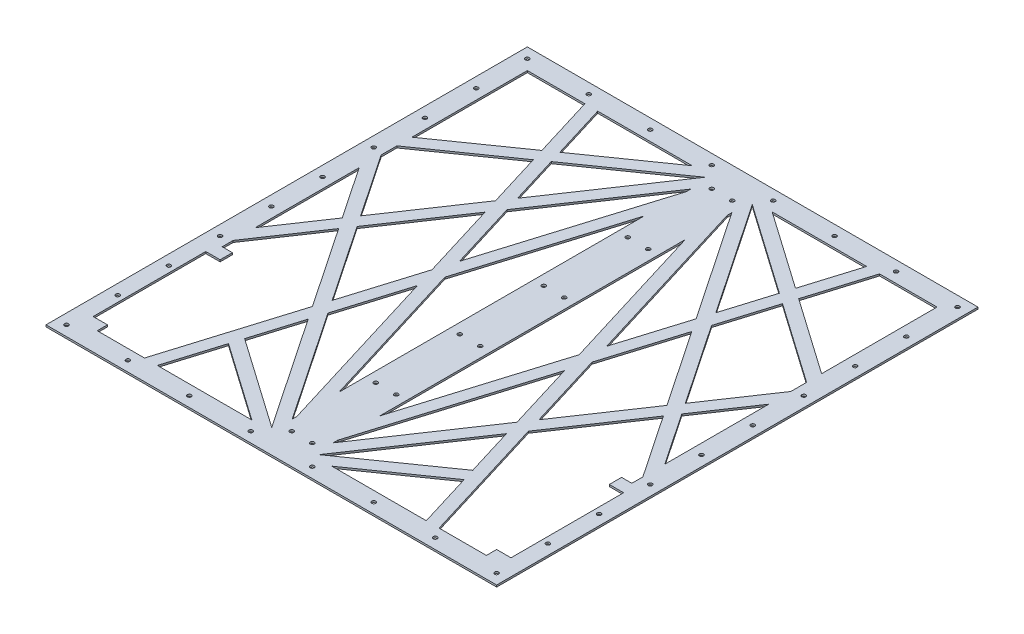
from build123d import *

# Parameters (mm, degrees)
SKETCH1_W                 = 558.8
SKETCH1_H                 = 596.9
BOSS_EXTRUDE1_DEPTH       = 2.286
CUT_EXTRUDE1_DEPTH        = 818.650460647
CUT_EXTRUDE2_REACH        = 819.65
SKETCH8_R                 = 2.4638
CUT_EXTRUDE3_DEPTH        = 818.650460647
LPATTERN1_COUNT           = 8
LPATTERN1_PITCH           = 76.2
LPATTERN2_COUNT           = 2
LPATTERN2_PITCH           = 571.5
LPATTERN2_COPY_1_SKETCH_R = 2.4638
LPATTERN2_COPY_1_DEPTH    = 818.650460647
LPATTERN2_COPY_2_SKETCH_R = 2.4638
LPATTERN2_COPY_2_DEPTH    = 818.650460647
LPATTERN2_COPY_3_SKETCH_R = 2.4638
LPATTERN2_COPY_3_DEPTH    = 818.650460647
LPATTERN2_COPY_4_SKETCH_R = 2.4638
LPATTERN2_COPY_4_DEPTH    = 818.650460647
LPATTERN2_COPY_5_SKETCH_R = 2.4638
LPATTERN2_COPY_5_DEPTH    = 818.650460647
LPATTERN2_COPY_6_SKETCH_R = 2.4638
LPATTERN2_COPY_6_DEPTH    = 818.650460647
LPATTERN2_COPY_7_SKETCH_R = 2.4638
LPATTERN2_COPY_7_DEPTH    = 818.650460647
LPATTERN3_COUNT           = 9
LPATTERN3_PITCH           = 63.5
LPATTERN4_COPY_1_SKETCH_R = 2.4638
LPATTERN4_COPY_1_DEPTH    = 818.650460647
LPATTERN4_COPY_2_SKETCH_R = 2.4638
LPATTERN4_COPY_2_DEPTH    = 818.650460647
LPATTERN4_COPY_3_SKETCH_R = 2.4638
LPATTERN4_COPY_3_DEPTH    = 818.650460647
LPATTERN4_COPY_4_SKETCH_R = 2.4638
LPATTERN4_COPY_4_DEPTH    = 818.650460647
LPATTERN4_COPY_5_SKETCH_R = 2.4638
LPATTERN4_COPY_5_DEPTH    = 818.650460647
LPATTERN4_COPY_6_SKETCH_R = 2.4638
LPATTERN4_COPY_6_DEPTH    = 818.650460647
LPATTERN4_COPY_7_SKETCH_R = 2.4638
LPATTERN4_COPY_7_DEPTH    = 818.650460647
LPATTERN4_COPY_8_SKETCH_R = 2.4638
LPATTERN4_COPY_8_DEPTH    = 818.650460647
LPATTERN4_COPY_9_SKETCH_R = 2.4638
LPATTERN4_COPY_9_DEPTH    = 818.650460647
SKETCH9_R                 = 2.4638
CUT_EXTRUDE4_DEPTH        = 818.650460647
LPATTERN5_COUNT           = 6
LPATTERN5_PITCH           = 104.14
CUT_EXTRUDE5_REACH        = 819.65


with BuildPart() as part:
    # Sketch1 → Boss-Extrude1 (new body)
    with BuildSketch(Plane(origin=(0, 0, 0), x_dir=(1, 0, 0), z_dir=(0, 1, 0))):
        with Locations((279.4, 298.45)):
            Rectangle(SKETCH1_W, SKETCH1_H)
    extrude(amount=BOSS_EXTRUDE1_DEPTH)

    # Sketch2 → Cut-Extrude1 (cut, through all)
    with BuildSketch(Plane(origin=(0, 2.286, 0), x_dir=(1, 0, 0), z_dir=(0, 1, 0))):
        Polygon((538.48, 38.1), (520.7, 38.1), (495.3, 76.2), (495.3, 139.7), (520.7, 177.8), (538.48, 177.8), align=None)
    cut_extrude1 = extrude(amount=-CUT_EXTRUDE1_DEPTH, mode=Mode.SUBTRACT)

    # Sketch5 → Cut-Extrude2 (cut, up to next)
    with BuildSketch(Plane(origin=(0, 2.286, 0), x_dir=(1, 0, 0), z_dir=(0, 1, 0)), mode=Mode.PRIVATE) as cut_extrude2_sk1:
        Polygon((510.850466187, 25.4), (480.06, 71.585699281), (480.06, 131.201342251), (438.618191365, 102.183475447), (462.093255638, 25.4), align=None)
    cut_extrude2_tool1 = extrude(cut_extrude2_sk1.sketch, amount=-CUT_EXTRUDE2_REACH, mode=Mode.PRIVATE) & part.part
    # Sketch5 → Cut-Extrude2 (cut, up to next)
    with BuildSketch(Plane(origin=(0, 2.286, 0), x_dir=(1, 0, 0), z_dir=(0, 1, 0)), mode=Mode.PRIVATE) as cut_extrude2_sk2:
        Polygon((328.960023954, 25.4), (446.156913269, 25.4), (425.491866124, 92.992323565), align=None)
    cut_extrude2_tool2 = extrude(cut_extrude2_sk2.sketch, amount=-CUT_EXTRUDE2_REACH, mode=Mode.PRIVATE) & part.part
    # Sketch5 → Cut-Extrude2 (cut, up to next)
    with BuildSketch(Plane(origin=(0, 2.286, 0), x_dir=(1, 0, 0), z_dir=(0, 1, 0)), mode=Mode.PRIVATE) as cut_extrude2_sk3:
        Polygon((420.806818807, 108.316422849), (402.356704291, 168.664028226), (308.707834351, 29.823868907), align=None)
    cut_extrude2_tool3 = extrude(cut_extrude2_sk3.sketch, amount=-CUT_EXTRUDE2_REACH, mode=Mode.PRIVATE) & part.part
    # Sketch5 → Cut-Extrude2 (cut, up to next)
    with BuildSketch(Plane(origin=(0, 2.286, 0), x_dir=(1, 0, 0), z_dir=(0, 1, 0)), mode=Mode.PRIVATE) as cut_extrude2_sk4:
        Polygon((433.933144048, 117.507574732), (486.926339115, 154.613809392), (512.543799521, 193.04), (533.4, 193.04), (533.4, 206.702731625), (480.707066852, 284.823217627), (413.322597793, 184.921633917), align=None)
    cut_extrude2_tool4 = extrude(cut_extrude2_sk4.sketch, amount=-CUT_EXTRUDE2_REACH, mode=Mode.PRIVATE) & part.part
    # Sketch5 → Cut-Extrude2 (cut, up to next)
    with BuildSketch(Plane(origin=(0, 2.286, 0), x_dir=(1, 0, 0), z_dir=(0, 1, 0)), mode=Mode.PRIVATE) as cut_extrude2_sk5:
        Polygon((533.4, 233.956296371), (533.4, 362.943703629), (489.898447619, 298.45), align=None)
    cut_extrude2_tool5 = extrude(cut_extrude2_sk5.sketch, amount=-CUT_EXTRUDE2_REACH, mode=Mode.PRIVATE) & part.part
    # Sketch5 → Cut-Extrude2 (cut, up to next)
    with BuildSketch(Plane(origin=(0, 2.286, 0), x_dir=(1, 0, 0), z_dir=(0, 1, 0)), mode=Mode.PRIVATE) as cut_extrude2_sk6:
        Polygon((407.589125574, 203.674976537), (378.613493066, 298.45), (407.589125574, 393.225023463), (471.515686084, 298.45), align=None)
    cut_extrude2_tool6 = extrude(cut_extrude2_sk6.sketch, amount=-CUT_EXTRUDE2_REACH, mode=Mode.PRIVATE) & part.part
    # Sketch5 → Cut-Extrude2 (cut, up to next)
    with BuildSketch(Plane(origin=(0, 2.286, 0), x_dir=(1, 0, 0), z_dir=(0, 1, 0)), mode=Mode.PRIVATE) as cut_extrude2_sk7:
        Polygon((304.8, 51.283830973), (304.8, 57.016942926), (370.645321881, 272.387286417), (396.623232072, 187.417370846), align=None)
    cut_extrude2_tool7 = extrude(cut_extrude2_sk7.sketch, amount=-CUT_EXTRUDE2_REACH, mode=Mode.PRIVATE) & part.part
    # Sketch5 → Cut-Extrude2 (cut, up to next)
    with BuildSketch(Plane(origin=(0, 2.286, 0), x_dir=(1, 0, 0), z_dir=(0, 1, 0)), mode=Mode.PRIVATE) as cut_extrude2_sk8:
        Polygon((362.677150697, 298.45), (304.8, 109.142370093), (304.8, 487.757629907), align=None)
    cut_extrude2_tool8 = extrude(cut_extrude2_sk8.sketch, amount=-CUT_EXTRUDE2_REACH, mode=Mode.PRIVATE) & part.part
    # Sketch5 → Cut-Extrude2 (cut, up to next)
    with BuildSketch(Plane(origin=(0, 2.286, 0), x_dir=(1, 0, 0), z_dir=(0, 1, 0)), mode=Mode.PRIVATE) as cut_extrude2_sk9:
        Polygon((480.707066852, 312.076782373), (533.4, 390.197268375), (533.4, 409.744982928), (433.933144048, 479.392425268), (413.322597793, 411.978366083), align=None)
    cut_extrude2_tool9 = extrude(cut_extrude2_sk9.sketch, amount=-CUT_EXTRUDE2_REACH, mode=Mode.PRIVATE) & part.part
    # Sketch5 → Cut-Extrude2 (cut, up to next)
    with BuildSketch(Plane(origin=(0, 2.286, 0), x_dir=(1, 0, 0), z_dir=(0, 1, 0)), mode=Mode.PRIVATE) as cut_extrude2_sk10:
        Polygon((370.645321881, 324.512713583), (396.623232072, 409.482629154), (304.8, 545.616169027), (304.8, 539.883057074), align=None)
    cut_extrude2_tool10 = extrude(cut_extrude2_sk10.sketch, amount=-CUT_EXTRUDE2_REACH, mode=Mode.PRIVATE) & part.part
    # Sketch5 → Cut-Extrude2 (cut, up to next)
    with BuildSketch(Plane(origin=(0, 2.286, 0), x_dir=(1, 0, 0), z_dir=(0, 1, 0)), mode=Mode.PRIVATE) as cut_extrude2_sk11:
        Polygon((308.707834351, 567.076131093), (402.356704291, 428.235971774), (420.806818807, 488.583577151), align=None)
    cut_extrude2_tool11 = extrude(cut_extrude2_sk11.sketch, amount=-CUT_EXTRUDE2_REACH, mode=Mode.PRIVATE) & part.part
    # Sketch5 → Cut-Extrude2 (cut, up to next)
    with BuildSketch(Plane(origin=(0, 2.286, 0), x_dir=(1, 0, 0), z_dir=(0, 1, 0)), mode=Mode.PRIVATE) as cut_extrude2_sk12:
        Polygon((533.4, 428.349587661), (533.4, 571.5), (462.093255638, 571.5), (438.618191365, 494.716524553), align=None)
    cut_extrude2_tool12 = extrude(cut_extrude2_sk12.sketch, amount=-CUT_EXTRUDE2_REACH, mode=Mode.PRIVATE) & part.part
    # Sketch5 → Cut-Extrude2 (cut, up to next)
    with BuildSketch(Plane(origin=(0, 2.286, 0), x_dir=(1, 0, 0), z_dir=(0, 1, 0)), mode=Mode.PRIVATE) as cut_extrude2_sk13:
        Polygon((425.491866124, 503.907676435), (446.156913269, 571.5), (328.960023954, 571.5), align=None)
    cut_extrude2_tool13 = extrude(cut_extrude2_sk13.sketch, amount=-CUT_EXTRUDE2_REACH, mode=Mode.PRIVATE) & part.part
    cut_extrude2_1 = cut_extrude2_tool1.solids().sort_by_distance((469.861035, 2.286, -70.494014))[0]
    add(cut_extrude2_1, mode=Mode.SUBTRACT)
    cut_extrude2_2 = cut_extrude2_tool2.solids().sort_by_distance((400.202934, 2.286, -47.930775))[0]
    add(cut_extrude2_2, mode=Mode.SUBTRACT)
    cut_extrude2_3 = cut_extrude2_tool3.solids().sort_by_distance((377.290452, 2.286, -102.268107))[0]
    add(cut_extrude2_3, mode=Mode.SUBTRACT)
    cut_extrude2_4 = cut_extrude2_tool4.solids().sort_by_distance((469.522406, 2.286, -198.688126))[0]
    add(cut_extrude2_4, mode=Mode.SUBTRACT)
    cut_extrude2_5 = cut_extrude2_tool5.solids().sort_by_distance((518.899483, 2.286, -298.45))[0]
    add(cut_extrude2_5, mode=Mode.SUBTRACT)
    cut_extrude2_6 = cut_extrude2_tool6.solids().sort_by_distance((419.239435, 2.286, -298.45))[0]
    add(cut_extrude2_6, mode=Mode.SUBTRACT)
    cut_extrude2_7 = cut_extrude2_tool7.solids().sort_by_distance((356.369994, 2.286, -168.962316))[0]
    add(cut_extrude2_7, mode=Mode.SUBTRACT)
    cut_extrude2_8 = cut_extrude2_tool8.solids().sort_by_distance((324.092384, 2.286, -298.45))[0]
    add(cut_extrude2_8, mode=Mode.SUBTRACT)
    cut_extrude2_9 = cut_extrude2_tool9.solids().sort_by_distance((471.732108, 2.286, -399.181411))[0]
    add(cut_extrude2_9, mode=Mode.SUBTRACT)
    cut_extrude2_10 = cut_extrude2_tool10.solids().sort_by_distance((356.369994, 2.286, -427.937684))[0]
    add(cut_extrude2_10, mode=Mode.SUBTRACT)
    cut_extrude2_11 = cut_extrude2_tool11.solids().sort_by_distance((377.290452, 2.286, -494.631893))[0]
    add(cut_extrude2_11, mode=Mode.SUBTRACT)
    cut_extrude2_12 = cut_extrude2_tool12.solids().sort_by_distance((494.972189, 2.286, -511.907911))[0]
    add(cut_extrude2_12, mode=Mode.SUBTRACT)
    cut_extrude2_13 = cut_extrude2_tool13.solids().sort_by_distance((400.202934, 2.286, -548.969225))[0]
    add(cut_extrude2_13, mode=Mode.SUBTRACT)
    cut_extrude2 = cut_extrude2_1 + cut_extrude2_2 + cut_extrude2_3 + cut_extrude2_4 + cut_extrude2_5 + cut_extrude2_6 + cut_extrude2_7 + cut_extrude2_8 + cut_extrude2_9 + cut_extrude2_10 + cut_extrude2_11 + cut_extrude2_12 + cut_extrude2_13  # Cut-Extrude2 as one shape, for the pattern or mirror that repeats it

    # Mirror1: Cut-Extrude1, Cut-Extrude2 across plane
    add(cut_extrude1.mirror(Plane.ZY.offset(-279.4)), mode=Mode.SUBTRACT)
    add(cut_extrude2.mirror(Plane.ZY.offset(-279.4)), mode=Mode.SUBTRACT)

    # Sketch8 → Cut-Extrude3 (cut, through all)
    with BuildSketch(Plane.XZ):
        with Locations(Location((12.7, -12.7, 0), (0, 0, 270))):
            Circle(SKETCH8_R)
    cut_extrude3 = extrude(amount=-CUT_EXTRUDE3_DEPTH, mode=Mode.SUBTRACT)

    # LPattern1: Cut-Extrude3 ×8
    with Locations(*[(i * LPATTERN1_PITCH, 0, 0) for i in range(1, LPATTERN1_COUNT)]):
        add(cut_extrude3, mode=Mode.SUBTRACT)

    # LPattern2: Cut-Extrude3 ×2
    with Locations(*[(0, 0, -i * LPATTERN2_PITCH) for i in range(1, LPATTERN2_COUNT)]):
        add(cut_extrude3, mode=Mode.SUBTRACT)

    # LPattern2 copy 1 sketch → LPattern2 copy 1 (cut, through all)
    with BuildSketch(Plane(origin=(76.2, 0, -571.5), x_dir=(1, 0, 0), z_dir=(0, -1, 0))):
        with Locations(Location((12.7, -12.7, 0), (0, 0, 270))):
            Circle(LPATTERN2_COPY_1_SKETCH_R)
    extrude(amount=-LPATTERN2_COPY_1_DEPTH, mode=Mode.SUBTRACT)

    # LPattern2 copy 2 sketch → LPattern2 copy 2 (cut, through all)
    with BuildSketch(Plane(origin=(152.4, 0, -571.5), x_dir=(1, 0, 0), z_dir=(0, -1, 0))):
        with Locations(Location((12.7, -12.7, 0), (0, 0, 270))):
            Circle(LPATTERN2_COPY_2_SKETCH_R)
    extrude(amount=-LPATTERN2_COPY_2_DEPTH, mode=Mode.SUBTRACT)

    # LPattern2 copy 3 sketch → LPattern2 copy 3 (cut, through all)
    with BuildSketch(Plane(origin=(228.6, 0, -571.5), x_dir=(1, 0, 0), z_dir=(0, -1, 0))):
        with Locations(Location((12.7, -12.7, 0), (0, 0, 270))):
            Circle(LPATTERN2_COPY_3_SKETCH_R)
    extrude(amount=-LPATTERN2_COPY_3_DEPTH, mode=Mode.SUBTRACT)

    # LPattern2 copy 4 sketch → LPattern2 copy 4 (cut, through all)
    with BuildSketch(Plane(origin=(304.8, 0, -571.5), x_dir=(1, 0, 0), z_dir=(0, -1, 0))):
        with Locations(Location((12.7, -12.7, 0), (0, 0, 270))):
            Circle(LPATTERN2_COPY_4_SKETCH_R)
    extrude(amount=-LPATTERN2_COPY_4_DEPTH, mode=Mode.SUBTRACT)

    # LPattern2 copy 5 sketch → LPattern2 copy 5 (cut, through all)
    with BuildSketch(Plane(origin=(381, 0, -571.5), x_dir=(1, 0, 0), z_dir=(0, -1, 0))):
        with Locations(Location((12.7, -12.7, 0), (0, 0, 270))):
            Circle(LPATTERN2_COPY_5_SKETCH_R)
    extrude(amount=-LPATTERN2_COPY_5_DEPTH, mode=Mode.SUBTRACT)

    # LPattern2 copy 6 sketch → LPattern2 copy 6 (cut, through all)
    with BuildSketch(Plane(origin=(457.2, 0, -571.5), x_dir=(1, 0, 0), z_dir=(0, -1, 0))):
        with Locations(Location((12.7, -12.7, 0), (0, 0, 270))):
            Circle(LPATTERN2_COPY_6_SKETCH_R)
    extrude(amount=-LPATTERN2_COPY_6_DEPTH, mode=Mode.SUBTRACT)

    # LPattern2 copy 7 sketch → LPattern2 copy 7 (cut, through all)
    with BuildSketch(Plane(origin=(533.4, 0, -571.5), x_dir=(1, 0, 0), z_dir=(0, -1, 0))):
        with Locations(Location((12.7, -12.7, 0), (0, 0, 270))):
            Circle(LPATTERN2_COPY_7_SKETCH_R)
    extrude(amount=-LPATTERN2_COPY_7_DEPTH, mode=Mode.SUBTRACT)

    # LPattern3: Cut-Extrude3 ×9
    with Locations(*[(0, 0, -i * LPATTERN3_PITCH) for i in range(1, LPATTERN3_COUNT)]):
        add(cut_extrude3, mode=Mode.SUBTRACT)

    # LPattern4 copy 1 sketch → LPattern4 copy 1 (cut, through all)
    with BuildSketch(Plane(origin=(533.4, 0, -63.5), x_dir=(1, 0, 0), z_dir=(0, -1, 0))):
        with Locations(Location((12.7, -12.7, 0), (0, 0, 270))):
            Circle(LPATTERN4_COPY_1_SKETCH_R)
    extrude(amount=-LPATTERN4_COPY_1_DEPTH, mode=Mode.SUBTRACT)

    # LPattern4 copy 2 sketch → LPattern4 copy 2 (cut, through all)
    with BuildSketch(Plane(origin=(533.4, 0, -127), x_dir=(1, 0, 0), z_dir=(0, -1, 0))):
        with Locations(Location((12.7, -12.7, 0), (0, 0, 270))):
            Circle(LPATTERN4_COPY_2_SKETCH_R)
    extrude(amount=-LPATTERN4_COPY_2_DEPTH, mode=Mode.SUBTRACT)

    # LPattern4 copy 3 sketch → LPattern4 copy 3 (cut, through all)
    with BuildSketch(Plane(origin=(533.4, 0, -190.5), x_dir=(1, 0, 0), z_dir=(0, -1, 0))):
        with Locations(Location((12.7, -12.7, 0), (0, 0, 270))):
            Circle(LPATTERN4_COPY_3_SKETCH_R)
    extrude(amount=-LPATTERN4_COPY_3_DEPTH, mode=Mode.SUBTRACT)

    # LPattern4 copy 4 sketch → LPattern4 copy 4 (cut, through all)
    with BuildSketch(Plane(origin=(533.4, 0, -254), x_dir=(1, 0, 0), z_dir=(0, -1, 0))):
        with Locations(Location((12.7, -12.7, 0), (0, 0, 270))):
            Circle(LPATTERN4_COPY_4_SKETCH_R)
    extrude(amount=-LPATTERN4_COPY_4_DEPTH, mode=Mode.SUBTRACT)

    # LPattern4 copy 5 sketch → LPattern4 copy 5 (cut, through all)
    with BuildSketch(Plane(origin=(533.4, 0, -317.5), x_dir=(1, 0, 0), z_dir=(0, -1, 0))):
        with Locations(Location((12.7, -12.7, 0), (0, 0, 270))):
            Circle(LPATTERN4_COPY_5_SKETCH_R)
    extrude(amount=-LPATTERN4_COPY_5_DEPTH, mode=Mode.SUBTRACT)

    # LPattern4 copy 6 sketch → LPattern4 copy 6 (cut, through all)
    with BuildSketch(Plane(origin=(533.4, 0, -381), x_dir=(1, 0, 0), z_dir=(0, -1, 0))):
        with Locations(Location((12.7, -12.7, 0), (0, 0, 270))):
            Circle(LPATTERN4_COPY_6_SKETCH_R)
    extrude(amount=-LPATTERN4_COPY_6_DEPTH, mode=Mode.SUBTRACT)

    # LPattern4 copy 7 sketch → LPattern4 copy 7 (cut, through all)
    with BuildSketch(Plane(origin=(533.4, 0, -444.5), x_dir=(1, 0, 0), z_dir=(0, -1, 0))):
        with Locations(Location((12.7, -12.7, 0), (0, 0, 270))):
            Circle(LPATTERN4_COPY_7_SKETCH_R)
    extrude(amount=-LPATTERN4_COPY_7_DEPTH, mode=Mode.SUBTRACT)

    # LPattern4 copy 8 sketch → LPattern4 copy 8 (cut, through all)
    with BuildSketch(Plane(origin=(533.4, 0, -508), x_dir=(1, 0, 0), z_dir=(0, -1, 0))):
        with Locations(Location((12.7, -12.7, 0), (0, 0, 270))):
            Circle(LPATTERN4_COPY_8_SKETCH_R)
    extrude(amount=-LPATTERN4_COPY_8_DEPTH, mode=Mode.SUBTRACT)

    # LPattern4 copy 9 sketch → LPattern4 copy 9 (cut, through all)
    with BuildSketch(Plane(origin=(533.4, 0, 0), x_dir=(1, 0, 0), z_dir=(0, -1, 0))):
        with Locations(Location((12.7, -12.7, 0), (0, 0, 270))):
            Circle(LPATTERN4_COPY_9_SKETCH_R)
    extrude(amount=-LPATTERN4_COPY_9_DEPTH, mode=Mode.SUBTRACT)

    # Sketch9 → Cut-Extrude4 (cut, through all)
    with BuildSketch(Plane.XZ):
        with Locations(Location((266.7, -38.1, 0), (0, 0, 270))):
            Circle(SKETCH9_R)
        with Locations(Location((292.1, -38.1, 0), (0, 0, 270))):
            Circle(SKETCH9_R)
    cut_extrude4 = extrude(amount=-CUT_EXTRUDE4_DEPTH, mode=Mode.SUBTRACT)

    # LPattern5: Cut-Extrude4 ×6
    with Locations(*[(0, 0, -i * LPATTERN5_PITCH) for i in range(1, LPATTERN5_COUNT)]):
        add(cut_extrude4, mode=Mode.SUBTRACT)

    # Sketch10 → Cut-Extrude5 (cut, up to next)
    with BuildSketch(Plane.XZ, mode=Mode.PRIVATE) as cut_extrude5_sk1:
        Polygon((116.675001359, -90.713225687), (120.181808635, -102.183475447), (124.866855952, -117.507574732), (71.873660885, -154.613809392), (46.256200479, -193.04), (38.1, -193.04), (38.1, -177.8), (38.1, -25.4), (47.949533813, -25.4), (96.706744362, -25.4), align=None)
    cut_extrude5_tool1 = extrude(cut_extrude5_sk1.sketch, amount=-CUT_EXTRUDE5_REACH, mode=Mode.PRIVATE) & part.part
    cut_extrude5 = cut_extrude5_tool1.solids().sort_by_distance((71.744226, 0, -95.859148))[0]
    add(cut_extrude5, mode=Mode.SUBTRACT)

    # Mirror2: Cut-Extrude5 across plane
    add(cut_extrude5.mirror(Plane.ZY.offset(-279.4)), mode=Mode.SUBTRACT)


solid = part.part
